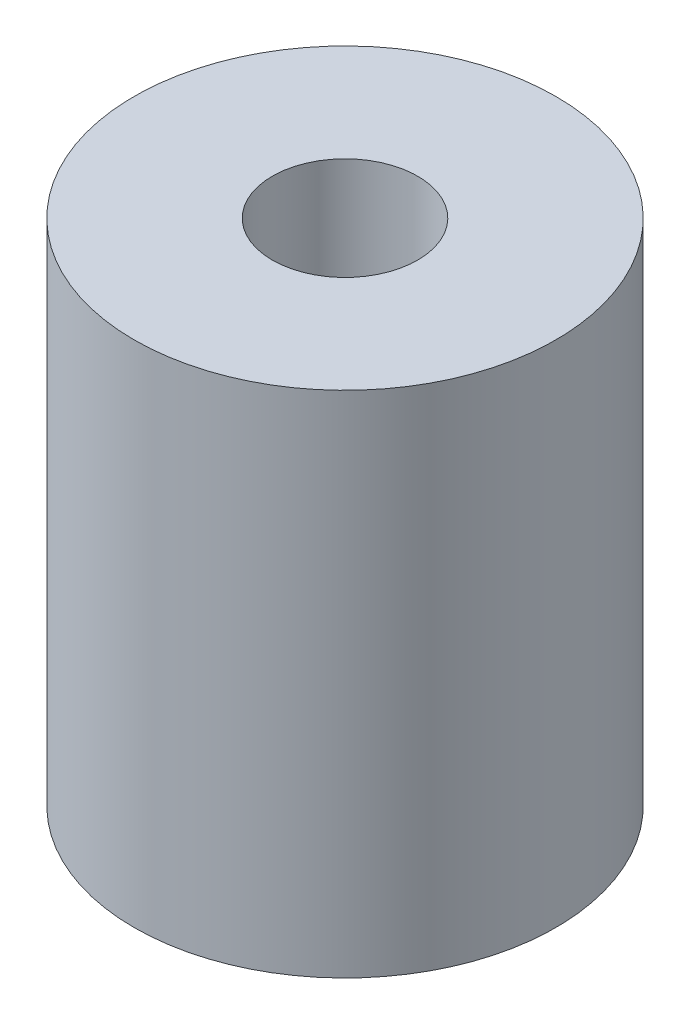
from build123d import *

# Parameters (mm, degrees)
SKETCH1_R           = 14.5
SKETCH1_R_2         = 5
BOSS_EXTRUDE1_DEPTH = 35


with BuildPart() as part:
    # Sketch1 → Boss-Extrude1 (new body)
    with BuildSketch(Plane(origin=(0, 0, 0), x_dir=(1, 0, 0), z_dir=(0, 1, 0))):
        with Locations(Location((0, 0, 0), (0, 0, 270))):
            Circle(SKETCH1_R)
        with Locations(Location((0, 0, 0), (0, 0, 270))):
            Circle(SKETCH1_R_2, mode=Mode.SUBTRACT)
    extrude(amount=BOSS_EXTRUDE1_DEPTH)


solid = part.part
